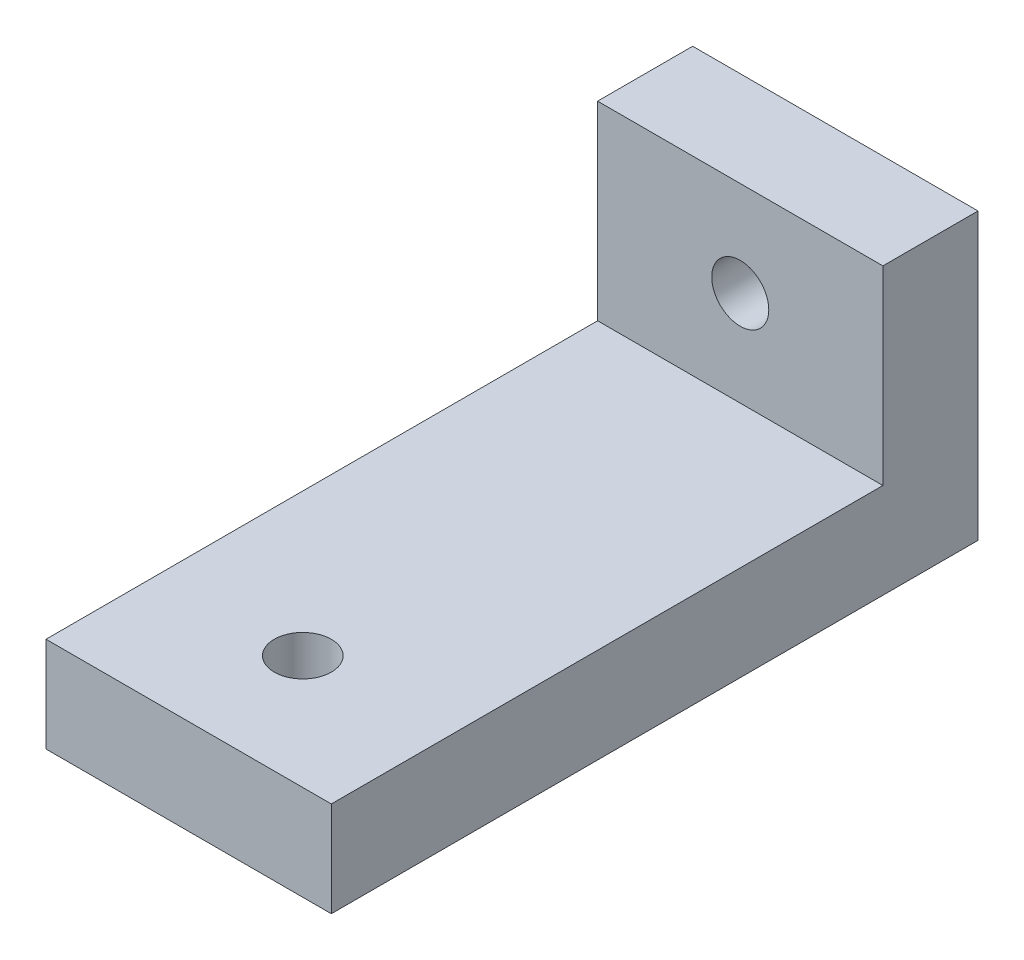
from build123d import *

# Parameters (mm, degrees)
SKETCH1_W      = 15
SKETCH1_H      = 34.5
EXTRUDE1_DEPTH = 5
SKETCH2_W      = 15
SKETCH2_H      = 5
EXTRUDE2_DEPTH = 10
SKETCH3_R      = 1.5
EXTRUDE3_DEPTH = 10
SKETCH4_R      = 1.5
EXTRUDE4_DEPTH = 10
SKETCH5_W      = 15
SKETCH5_H      = 15
EXTRUDE5_DEPTH = 0.5
EXTRUDE6_START = 0.5
SKETCH6_W      = 15
SKETCH6_H      = 10
SKETCH6_R      = 1.5
EXTRUDE6_DEPTH = 0.5


with BuildPart() as part:
    # Sketch1 → Extrude1 (new body)
    with BuildSketch(Plane(origin=(0, 0, 0), x_dir=(1, 0, 0), z_dir=(0, 1, 0))):
        Rectangle(SKETCH1_W, SKETCH1_H)
    extrude(amount=EXTRUDE1_DEPTH)

    # Sketch2 → Extrude2 (add)
    with BuildSketch(Plane(origin=(0, 5, 0), x_dir=(1, 0, 0), z_dir=(0, 1, 0))):
        with Locations((0, 14.75)):
            Rectangle(SKETCH2_W, SKETCH2_H)
    extrude(amount=EXTRUDE2_DEPTH)

    # Sketch3 → Extrude3 (cut)
    with BuildSketch(Plane(origin=(0, 5, 0), x_dir=(1, 0, 0), z_dir=(0, 1, 0))):
        with Locations(Location((0, -11.25, 0), (0, 0, 270))):
            Circle(SKETCH3_R)
    extrude(amount=-EXTRUDE3_DEPTH, mode=Mode.SUBTRACT)

    # Sketch4 → Extrude4 (cut)
    with BuildSketch(Plane.XY.offset(-12.25)):
        with Locations((0, 10)):
            Circle(SKETCH4_R)
    extrude(amount=-EXTRUDE4_DEPTH, mode=Mode.SUBTRACT)

    # Sketch5 → Extrude5 (cut)
    with BuildSketch(Plane(origin=(0, 0, -17.25), x_dir=(-1, 0, 0), z_dir=(0, 0, -1))):
        with Locations((0, 7.5)):
            Rectangle(SKETCH5_W, SKETCH5_H)
    extrude(amount=-EXTRUDE5_DEPTH, mode=Mode.SUBTRACT)

    # Sketch6 → Extrude6 (add)
    with BuildSketch(Plane.XY.offset(-12.25).offset(EXTRUDE6_START)):
        with Locations((0, 10)):
            Rectangle(SKETCH6_W, SKETCH6_H)
        with Locations((0, 10)):
            Circle(SKETCH6_R, mode=Mode.SUBTRACT)
    extrude(amount=-EXTRUDE6_DEPTH)


solid = part.part
